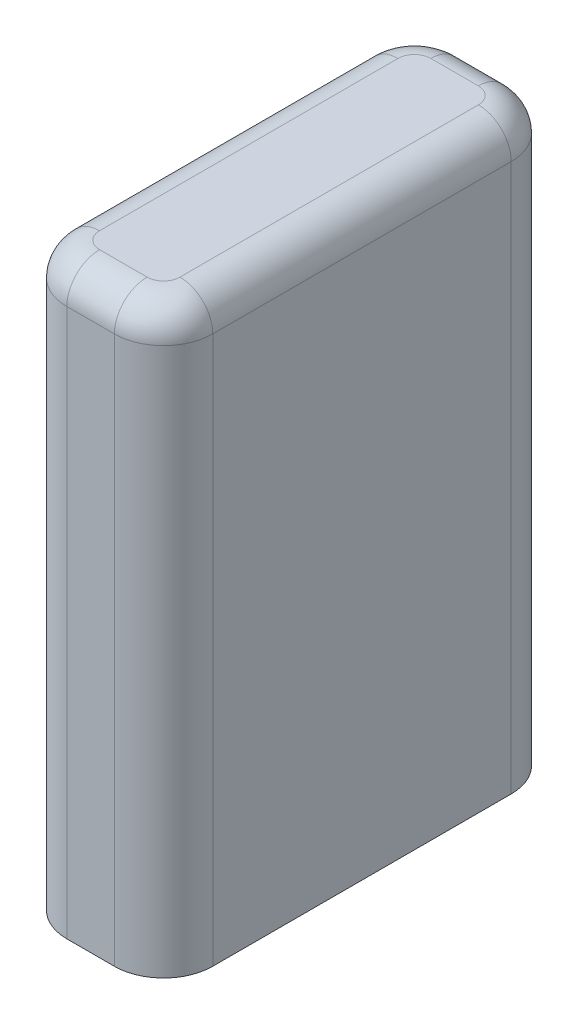
from build123d import *

# Parameters (mm, degrees)
BOSS_EXTRUDE1_DEPTH = 35.4
FILLET1_R           = 2


with BuildPart() as part:
    # Sketch1 → Boss-Extrude1 (new body)
    with BuildSketch(Plane(origin=(0, 0, 0), x_dir=(1, 0, 0), z_dir=(0, 1, 0))):
        with BuildLine():
            Line((-0.93255814, 13.039534884), (1.96744186, 13.039534884))
            ThreePointArc((1.96744186, 13.039534884), (4.088762204, 12.160855227), (4.96744186, 10.039534884))
            Line((4.96744186, 10.039534884), (4.96744186, -8.160465116))
            ThreePointArc((4.96744186, -8.160465116), (4.088762204, -10.28178546), (1.96744186, -11.160465116))
            Line((1.96744186, -11.160465116), (-0.93255814, -11.160465116))
            ThreePointArc((-0.93255814, -11.160465116), (-3.053878483, -10.28178546), (-3.93255814, -8.160465116))
            Line((-3.93255814, -8.160465116), (-3.93255814, 10.039534884))
            ThreePointArc((-3.93255814, 10.039534884), (-3.053878483, 12.160855227), (-0.93255814, 13.039534884))
        make_face()
    extrude(amount=BOSS_EXTRUDE1_DEPTH)

    # Fillet1
    fillet1_edges = [part.edges().sort_by_distance(p)[0] for p in [
        (4.088762204, 35.4, -12.160855227),
        (0.51744186, 35.4, -13.039534884),
        (-3.053878483, 35.4, -12.160855227),
        (-3.93255814, 35.4, -0.939534884),
        (-3.053878483, 35.4, 10.28178546),
        (0.51744186, 35.4, 11.160465116),
        (4.088762204, 35.4, 10.28178546),
        (4.96744186, 35.4, -0.939534884),
    ]]
    fillet(fillet1_edges, radius=FILLET1_R)


solid = part.part
